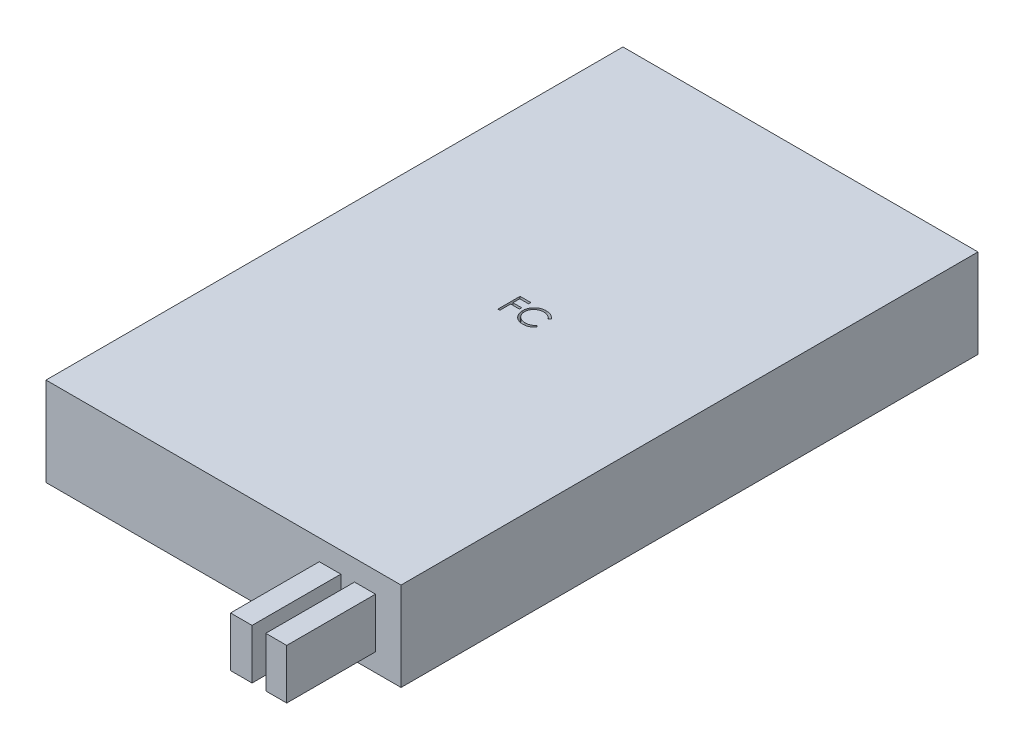
from build123d import *

# Parameters (mm, degrees)
SKETCH1_W           = 50.8
SKETCH1_H           = 82.55
BOSS_EXTRUDE1_DEPTH = 12.7
CUT_EXTRUDE1_DEPTH  = 1.27
SKETCH3_W           = 2.998982734
SKETCH3_H           = 7.14554636
SKETCH3_W_2         = 3.079931229
BOSS_EXTRUDE2_DEPTH = 12.7


with BuildPart() as part:
    # Sketch1 → Boss-Extrude1 (new body)
    with BuildSketch(Plane(origin=(0, 0, 0), x_dir=(1, 0, 0), z_dir=(0, 1, 0))):
        Rectangle(SKETCH1_W, SKETCH1_H)
    extrude(amount=BOSS_EXTRUDE1_DEPTH)

    # Sketch2 → Cut-Extrude1 (cut)
    with BuildSketch(Plane(origin=(0, 12.7, 0), x_dir=(1, 0, 0), z_dir=(0, 1, 0))):
        Polygon((-1.861676083, 3.013416612), (-0.314881211, 3.013416612), (-0.314881211, 2.687775586), (-1.576740185, 2.687775586), (-1.576740185, 1.710852509), (-0.314881211, 1.710852509), (-0.314881211, 1.385211483), (-1.576740185, 1.385211483), (-1.576740185, -0.161583388), (-1.861676083, -0.161583388), align=None)
        with BuildLine():
            Line((3.185759815, 2.430824464), (2.936440905, 2.240019176))
            add(Edge.make_bspline(
                [(2.936440905, 2.240019176), (2.918655563, 2.261215448), (2.883324665, 2.303322222), (2.826483817, 2.36244938), (2.767245898, 2.417844296), (2.705633552, 2.469770858), (2.64053778, 2.51641321), (2.573535484, 2.560201996), (2.503505828, 2.599452015), (2.406666755, 2.647043439), (2.279986207, 2.696706022), (2.120515174, 2.73834681), (1.954044392, 2.764854591), (1.840472284, 2.767725555), (1.782704927, 2.769185842)],
                knots=[0, 0, 0, 0, 0.757959112, 1.505699292, 2.245454638, 2.979532153, 3.711538275, 4.438200793, 5.171680507, 5.909471876, 7.393775596, 8.890124382, 10.418191784, 12, 12, 12, 12], degree=3))
            add(Edge.make_bspline(
                [(1.782704927, 2.769185842), (1.750879363, 2.768819391), (1.687523605, 2.768089888), (1.593499633, 2.758465896), (1.501231365, 2.744939298), (1.410778821, 2.724868469), (1.322257137, 2.699493308), (1.235087601, 2.669171682), (1.150532271, 2.631656935), (1.06742144, 2.590193013), (0.987793156, 2.543359546), (0.912450363, 2.492275291), (0.841667849, 2.437511896), (0.775389622, 2.378864107), (0.713547926, 2.316596042), (0.656590866, 2.250044104), (0.604715529, 2.179421061), (0.556893657, 2.105658184), (0.514064963, 2.02897033), (0.478205715, 1.949073659), (0.446451069, 1.867336366), (0.421323898, 1.782834956), (0.40143523, 1.696164018), (0.387712278, 1.607090946), (0.378197736, 1.515801822), (0.377471861, 1.453926232), (0.377105969, 1.422736523)],
                knots=[0, 0, 0, 0, 1.054917814, 2.100044995, 3.131103042, 4.146048494, 5.169673617, 6.183595914, 7.203665975, 8.234915748, 9.262203917, 10.264457458, 11.251630812, 12.227803204, 13.197192746, 14.159520551, 15.12972552, 16.100847026, 17.073214652, 18.039054194, 19.002613845, 19.979014051, 20.95965708, 21.949030935, 22.966165397, 24, 24, 24, 24], degree=3))
            add(Edge.make_bspline(
                [(0.377105969, 1.422736523), (0.378250619, 1.375808826), (0.380497988, 1.283672517), (0.400498976, 1.14871632), (0.430892881, 1.019429709), (0.476445582, 0.896620852), (0.532615007, 0.778775413), (0.603590419, 0.66788731), (0.685792563, 0.562280855), (0.780384358, 0.464451896), (0.884166777, 0.375085873), (0.995516668, 0.296390703), (1.114156701, 0.230790774), (1.23877693, 0.176202594), (1.370336333, 0.134241134), (1.508598332, 0.104700822), (1.653262214, 0.085431129), (1.752113026, 0.083586284), (1.802421474, 0.082647381)],
                knots=[0, 0, 0, 0, 1.029171465, 2.020641659, 2.987623507, 3.938342917, 4.889210282, 5.84687017, 6.821220943, 7.821438502, 8.827599549, 9.822697543, 10.807740252, 11.797342354, 12.80366471, 13.83203677, 14.896651826, 16, 16, 16, 16], degree=3))
            add(Edge.make_bspline(
                [(1.802421474, 0.082647381), (1.857850341, 0.084179345), (1.966947613, 0.087194618), (2.126938608, 0.11273908), (2.280096767, 0.154157334), (2.426430328, 0.212121877), (2.565526757, 0.28747396), (2.697603727, 0.37882132), (2.822772723, 0.487032879), (2.89803953, 0.569658288), (2.936440905, 0.611814047)],
                knots=[0, 0, 0, 0, 1.028121516, 2.023589091, 2.998037872, 3.967518031, 4.937445131, 5.927275754, 6.942489185, 8, 8, 8, 8], degree=3))
            Line((2.936440905, 0.611814047), (3.185759815, 0.422916812))
            add(Edge.make_bspline(
                [(3.185759815, 0.422916812), (3.16569553, 0.397028359), (3.125663066, 0.345375458), (3.060840436, 0.27255755), (2.992553173, 0.204064603), (2.920294065, 0.140448832), (2.844894354, 0.080437281), (2.765000185, 0.025734906), (2.681661848, -0.024421825), (2.595161714, -0.070347678), (2.505591686, -0.111094038), (2.413059092, -0.145977098), (2.317962784, -0.176026105), (2.220298416, -0.200747505), (2.119863408, -0.220043417), (2.017020192, -0.232942693), (1.911546805, -0.241780001), (1.84038923, -0.242585468), (1.804329526, -0.242993645)],
                knots=[0, 0, 0, 0, 0.986787822, 1.968848986, 2.935600012, 3.899624008, 4.868462664, 5.837806735, 6.815139263, 7.798259679, 8.787526145, 9.778297419, 10.776456485, 11.791383307, 12.812564526, 13.85620153, 14.913611965, 16, 16, 16, 16], degree=3))
            add(Edge.make_bspline(
                [(1.804329526, -0.242993645), (1.770181343, -0.24275598), (1.702657538, -0.242286028), (1.602963671, -0.234673133), (1.505908837, -0.224286586), (1.411770426, -0.208647324), (1.32003472, -0.190192101), (1.231533333, -0.165453176), (1.145395392, -0.137740717), (1.061966969, -0.105169765), (0.981177098, -0.0684158), (0.903286355, -0.026876314), (0.828330563, 0.019099377), (0.755572788, 0.068497851), (0.686087837, 0.122905832), (0.619273568, 0.181567708), (0.554755321, 0.24428576), (0.5148386, 0.289511234), (0.49476923, 0.312249745)],
                knots=[0, 0, 0, 0, 1.114604814, 2.203992996, 3.262667896, 4.300477797, 5.318619304, 6.316056647, 7.298880507, 8.271930387, 9.238335007, 10.195173496, 11.151986948, 12.108099108, 13.064862484, 14.031167946, 15.010108607, 16, 16, 16, 16], degree=3))
            add(Edge.make_bspline(
                [(0.49476923, 0.312249745), (0.462624039, 0.351747823), (0.398721742, 0.430267125), (0.316964872, 0.557526551), (0.246981019, 0.69039414), (0.190397148, 0.829567933), (0.146162382, 0.974735634), (0.115518013, 1.125970422), (0.095604771, 1.283131055), (0.093327581, 1.390025856), (0.092170071, 1.444361123)],
                knots=[0, 0, 0, 0, 0.994628077, 1.977248131, 2.950237994, 3.925870899, 4.908910175, 5.911660606, 6.938484602, 8, 8, 8, 8], degree=3))
            add(Edge.make_bspline(
                [(0.092170071, 1.444361123), (0.093580854, 1.501470713), (0.096356481, 1.613830266), (0.119938381, 1.778725209), (0.157874003, 1.936705407), (0.211755467, 2.087475946), (0.280068178, 2.231829843), (0.364456606, 2.368664365), (0.463940371, 2.498854605), (0.577739236, 2.620425129), (0.702532462, 2.731585828), (0.836171672, 2.829381455), (0.978395295, 2.910768059), (1.127636489, 2.978800292), (1.285012786, 3.031092055), (1.450188413, 3.06769816), (1.622853, 3.090482973), (1.740656772, 3.09336334), (1.800513421, 3.094826868)],
                knots=[0, 0, 0, 0, 1.032925535, 2.032216505, 3.007276963, 3.968222605, 4.92396291, 5.891752235, 6.871517503, 7.883894988, 8.900124299, 9.891468569, 10.874487609, 11.85992873, 12.854644235, 13.869047385, 14.917252991, 16, 16, 16, 16], degree=3))
            add(Edge.make_bspline(
                [(1.800513421, 3.094826868), (1.836993692, 3.0943895), (1.909202714, 3.093523773), (2.016021192, 3.085081773), (2.12001816, 3.071008716), (2.221265265, 3.051853424), (2.320255067, 3.02807964), (2.416231, 2.997109512), (2.509756237, 2.961697801), (2.600240932, 2.92091405), (2.687250946, 2.875133506), (2.770759177, 2.824863619), (2.850102299, 2.77016671), (2.925838612, 2.711507972), (2.996701175, 2.647646422), (3.064701944, 2.580338603), (3.127531637, 2.507645776), (3.166314892, 2.456478444), (3.185759815, 2.430824464)],
                knots=[0, 0, 0, 0, 1.096760587, 2.17092713, 3.219439832, 4.250915756, 5.268269357, 6.278326846, 7.281116186, 8.274029601, 9.260640565, 10.235837813, 11.203064059, 12.156899882, 13.114053108, 14.069676657, 15.032185724, 16, 16, 16, 16], degree=3))
        make_face()
    extrude(amount=-CUT_EXTRUDE1_DEPTH, mode=Mode.SUBTRACT)

    # Sketch3 → Boss-Extrude2 (add)
    with BuildSketch(Plane.XY.offset(41.275)):
        with Locations((20.244451429, 6.168632911)):
            Rectangle(SKETCH3_W, SKETCH3_H)
        with Locations((15.24371534, 6.168632911)):
            Rectangle(SKETCH3_W_2, SKETCH3_H)
    extrude(amount=BOSS_EXTRUDE2_DEPTH)


solid = part.part
